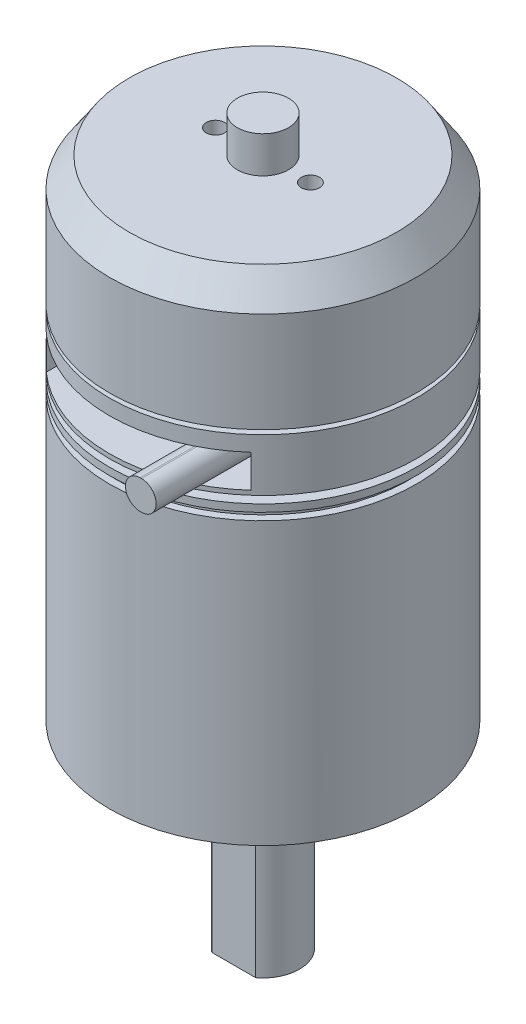
from build123d import *

# Parameters (mm, degrees)
SKETCH_2_W             = 28
SKETCH_2_H             = 4.5
CUT_EXTRUDE_1_DEPTH    = 10
EXTRUDE_1_DEPTH        = 15
HOLE_WIZARD_M3_1_D     = 2.5
HOLE_WIZARD_M3_1_DEPTH = 4
HOLE_WIZARD_M3_1_TIP   = 0.751075774
CUT_EXTRUDE_START      = -20
CUT_EXTRUDE_2_DEPTH    = 20
HOLE_WIZARD_M4_1_D     = 3.3
HOLE_WIZARD_M4_1_DEPTH = 10.1
HOLE_WIZARD_M4_1_TIP   = 0.991420021


with BuildPart() as part:
    # 草图1 → 旋转1 (revolve)
    with BuildSketch(Plane.XY, mode=Mode.PRIVATE) as revolve_1_sk:
        Polygon((0, 0), (4.1, 0), (4.1, 6.7), (13.4, 6.7), (13.4, 8.7), (21, 8.7), (21, 10.2), (20, 10.2), (20, 11.2), (21, 11.2), (21, 12.2), (10, 12.2), (10, 13.2), (21, 13.2), (21, 20.4), (5, 20.4), (5, 21), (21, 21), (21, 34.7), (18.3, 38.7), (3.5, 38.7), (3.5, 43.7), (0, 43.7), align=None)
    revolve(revolve_1_sk.sketch.rotate(Axis((0, 43.7, 0), (0, -1, 0)), 90), axis=Axis((0, 43.7, 0), (0, -1, 0)))

    # 草图2 → 切除-拉伸1 (cut)
    with BuildSketch(Plane.XY.offset(21)):
        with Locations((0, 16.05)):
            Rectangle(SKETCH_2_W, SKETCH_2_H)
    extrude(amount=-CUT_EXTRUDE_1_DEPTH, mode=Mode.SUBTRACT)

    # 草图3 → 凸台-拉伸1 (add)
    with BuildSketch(Plane.XY.offset(11)):
        with BuildLine():
            Line((9.185056323, 18.053194417), (9.385056323, 18.053194417))
            ThreePointArc((9.385056323, 18.053194417), (11.385056323, 16.053194417), (9.385056323, 14.053194417))
            Line((9.385056323, 14.053194417), (9.185056323, 14.053194417))
            ThreePointArc((9.185056323, 14.053194417), (7.185056323, 16.053194417), (9.185056323, 18.053194417))
        make_face()
    extrude(amount=EXTRUDE_1_DEPTH)

    # M3 螺纹孔1
    with Locations(Plane(origin=(0, 38.7, 0), x_dir=(1, 0, 0), z_dir=(0, 1, 0))):
        with Locations((-6.5, 0), (6.5, 0)):
            Hole(HOLE_WIZARD_M3_1_D / 2, depth=HOLE_WIZARD_M3_1_DEPTH)
            with Locations((0, 0, -(HOLE_WIZARD_M3_1_DEPTH + HOLE_WIZARD_M3_1_TIP / 2))):  # 118° drill point
                Cone(0, HOLE_WIZARD_M3_1_D / 2, HOLE_WIZARD_M3_1_TIP, mode=Mode.SUBTRACT)

    # 草图7 → 旋转2 (revolve)
    with BuildSketch(Plane.XY, mode=Mode.PRIVATE) as revolve_2_sk:
        Polygon((0, -55.3), (5, -55.3), (5, -31.2), (8.275, -31.2), (8.275, -30.3), (13, -30.3), (13, -28.3), (21, -28.3), (21, 8.7), (0, 8.7), align=None)
    revolve(revolve_2_sk.sketch.rotate(Axis((0, 8.7, 0), (0, -1, 0)), 180), axis=Axis((0, 8.7, 0), (0, -1, 0)))

    # 草图8 → 切除-拉伸2 (cut)
    with BuildSketch(Plane.XZ.offset(55.3).offset(CUT_EXTRUDE_START)):
        with BuildLine():
            Line((-3, 4), (3, 4))
            ThreePointArc((3, 4), (0, 5), (-3, 4))
        make_face()
    extrude(amount=CUT_EXTRUDE_2_DEPTH, mode=Mode.SUBTRACT)

    # M4 螺纹孔1
    with Locations(Plane(origin=(0, -28.3, 0), x_dir=(-1, 0, 0), z_dir=(0, -1, 0))):
        with Locations((17.5, 0), (0, -17.5), (-17.5, 0), (0, 17.5)):
            Hole(HOLE_WIZARD_M4_1_D / 2, depth=HOLE_WIZARD_M4_1_DEPTH)
            with Locations((0, 0, -(HOLE_WIZARD_M4_1_DEPTH + HOLE_WIZARD_M4_1_TIP / 2))):  # 118° drill point
                Cone(0, HOLE_WIZARD_M4_1_D / 2, HOLE_WIZARD_M4_1_TIP, mode=Mode.SUBTRACT)


solid = part.part
